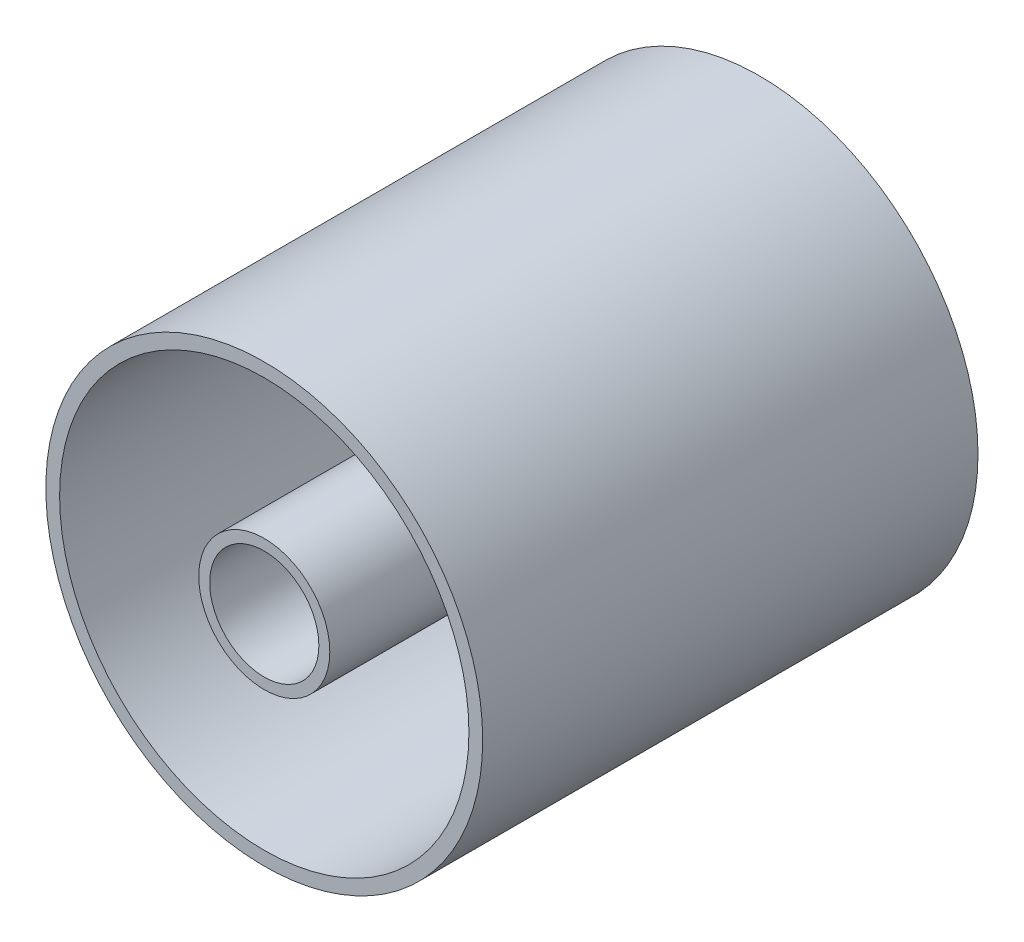
from build123d import *

# Parameters (mm, degrees)
CROQUIS1_R              = 31.75
CROQUIS1_R_2            = 7.9375
SALIENTE_EXTRUIR1_DEPTH = 2
CROQUIS2_R              = 31.75
CROQUIS2_R_2            = 29.75
SALIENTE_EXTRUIR2_DEPTH = 70
CROQUIS3_R              = 9.525
CROQUIS3_R_2            = 7.9375
SALIENTE_EXTRUIR3_DEPTH = 70


with BuildPart() as part:
    # Croquis1 → Saliente-Extruir1 (new body)
    with BuildSketch(Plane.XY):
        Circle(CROQUIS1_R)
        Circle(CROQUIS1_R_2, mode=Mode.SUBTRACT)
    extrude(amount=SALIENTE_EXTRUIR1_DEPTH)

    # Croquis2 → Saliente-Extruir2 (add)
    with BuildSketch(Plane.XY.offset(2)):
        Circle(CROQUIS2_R)
        Circle(CROQUIS2_R_2, mode=Mode.SUBTRACT)
    extrude(amount=SALIENTE_EXTRUIR2_DEPTH)

    # Croquis3 → Saliente-Extruir3 (add)
    with BuildSketch(Plane.XY.offset(2)):
        Circle(CROQUIS3_R)
        Circle(CROQUIS3_R_2, mode=Mode.SUBTRACT)
    extrude(amount=SALIENTE_EXTRUIR3_DEPTH)


solid = part.part
